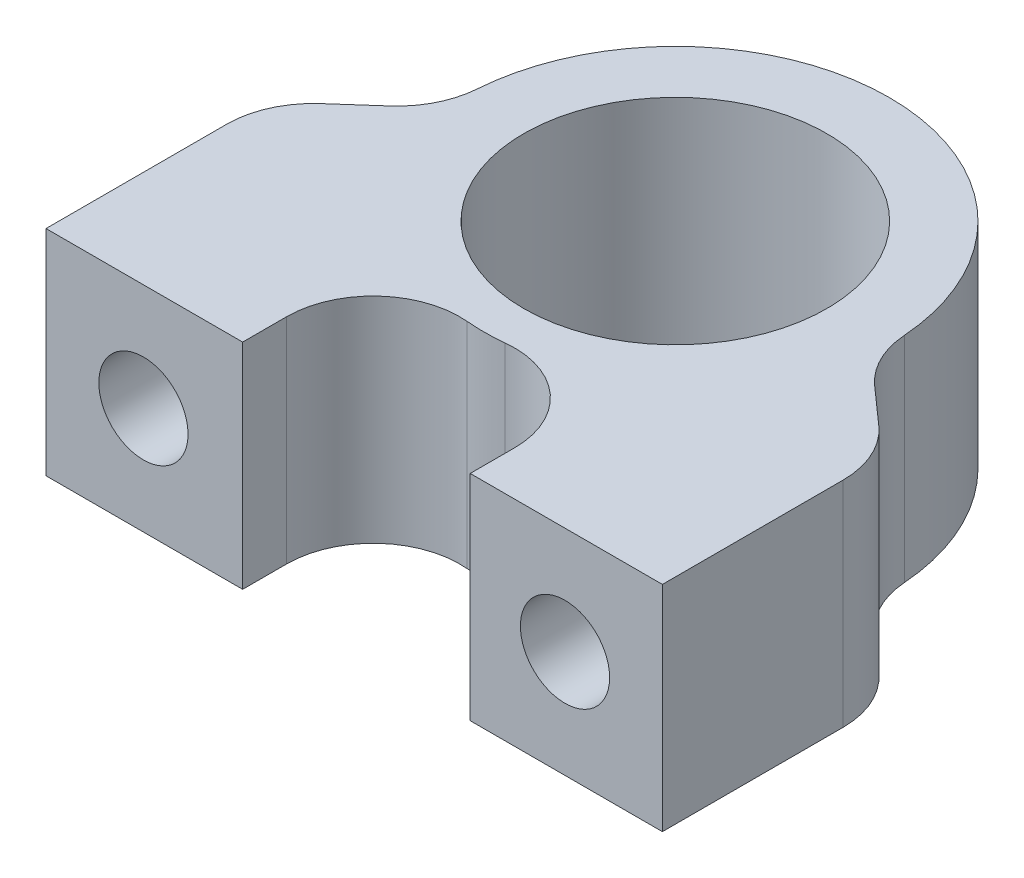
from build123d import *

# Parameters (mm, degrees)
SKETCH1_R           = 8.4935
BOSS_EXTRUDE1_DEPTH = 12
SKETCH2_R           = 2.5
CUT_EXTRUDE1_DEPTH  = 10.5
CUT_EXTRUDE2_DEPTH  = 20
FILLET1_R           = 4.85


with BuildPart() as part:
    # Sketch1 → Boss-Extrude1 (new body)
    with BuildSketch(Plane(origin=(0, 0, 0), x_dir=(1, 0, 0), z_dir=(0, 1, 0))):
        with BuildLine():
            Line((-11.9935, 0), (-11.9935, -1))
            Line((-11.9935, -1), (-17.270132019, -5.684762464))
            Line((-17.270132019, -5.684762464), (-17.270132019, -17.9935))
            Line((-17.270132019, -17.9935), (-16, -17.9935))
            Line((-16, -17.9935), (16, -17.9935))
            Line((16, -17.9935), (17.270132019, -17.9935))
            Line((17.270132019, -17.9935), (17.270132019, -5.684762464))
            Line((17.270132019, -5.684762464), (11.9935, -1))
            Line((11.9935, -1), (11.9935, 0))
            ThreePointArc((11.9935, 0), (0, 11.9935), (-11.9935, 0))
        make_face()
        with Locations(Location((0, 0, 0), (0, 0, 270))):
            Circle(SKETCH1_R, mode=Mode.SUBTRACT)
    extrude(amount=BOSS_EXTRUDE1_DEPTH)

    # Sketch2 → Cut-Extrude1 (cut)
    with BuildSketch(Plane.XY.offset(17.9935)):
        with Locations((-11.811421167, 6)):
            Circle(SKETCH2_R)
        with Locations((11.811421167, 6)):
            Circle(SKETCH2_R)
    extrude(amount=-CUT_EXTRUDE1_DEPTH, mode=Mode.SUBTRACT)

    # Sketch3 → Cut-Extrude2 (cut)
    with BuildSketch(Plane(origin=(0, 12, 0), x_dir=(1, 0, 0), z_dir=(0, 1, 0))):
        with BuildLine():
            Line((-6.25, -17.9935), (-6.25, -8.738437632))
            ThreePointArc((-6.25, -8.738437632), (0.155303572, -10.742377439), (6.5, -8.55410967))
            Line((6.5, -8.55410967), (6.5, -17.9935))
            Line((6.5, -17.9935), (-6.25, -17.9935))
        make_face()
    extrude(amount=-CUT_EXTRUDE2_DEPTH, mode=Mode.SUBTRACT)

    # Fillet1
    fillet1_edges = [part.edges().sort_by_distance(p)[0] for p in [
        (6.5, 6, 8.55410967),
        (-6.25, 6, 8.738437632),
        (-17.270132019, 6, 5.684762464),
        (-11.9935, 6, 1),
        (11.9935, 6, 1),
        (17.270132019, 6, 5.684762464),
    ]]
    fillet(fillet1_edges, radius=FILLET1_R)


solid = part.part
